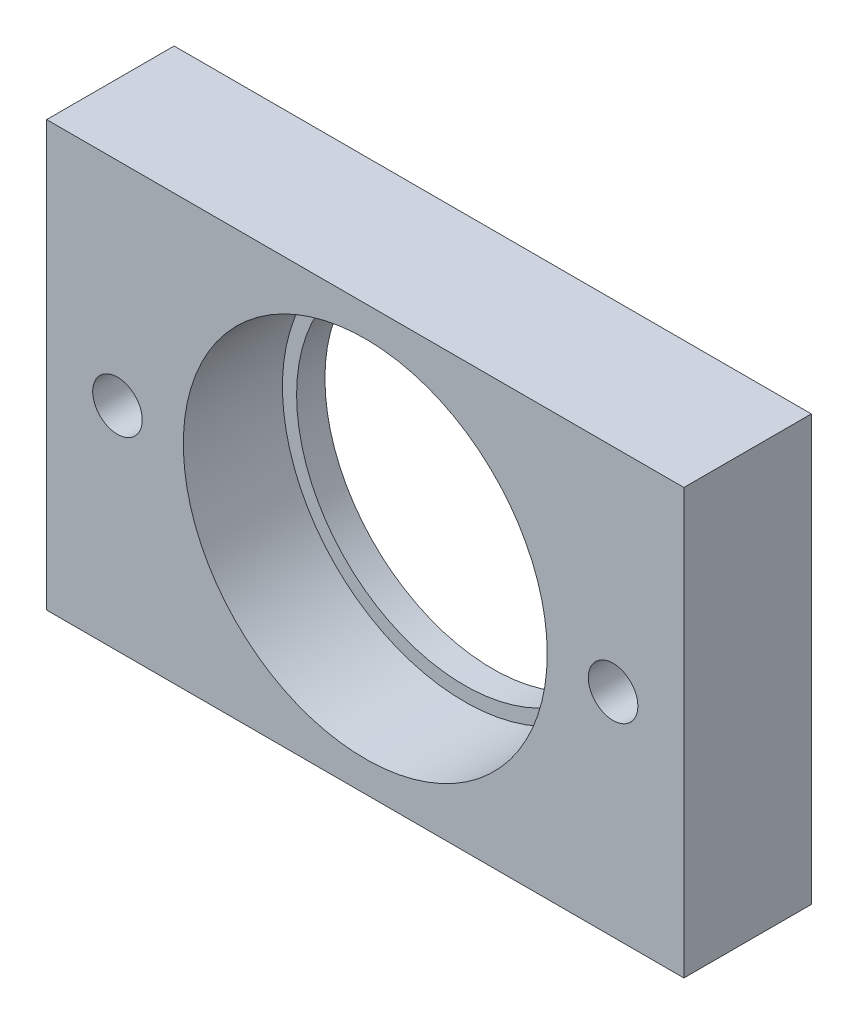
from build123d import *

# Parameters (mm, degrees)
SKIZZE1_W                       = 45
SKIZZE1_H                       = 30
SKIZZE1_R                       = 11.85
SKIZZE1_R_2                     = 1.75
AUFSATZ_LINEAR_AUSTRAGEN1_DEPTH = 9
SKIZZE3_R                       = 12.85
SCHNITT_LINEAR_AUSTRAGEN1_DEPTH = 7


with BuildPart() as part:
    # Skizze1 → Aufsatz-Linear austragen1 (new body)
    with BuildSketch(Plane.XY):
        Rectangle(SKIZZE1_W, SKIZZE1_H)
        Circle(SKIZZE1_R, mode=Mode.SUBTRACT)
        with Locations((-17.5, 0)):
            Circle(SKIZZE1_R_2, mode=Mode.SUBTRACT)
        with Locations((17.5, 0)):
            Circle(SKIZZE1_R_2, mode=Mode.SUBTRACT)
    extrude(amount=AUFSATZ_LINEAR_AUSTRAGEN1_DEPTH)

    # Skizze3 → Schnitt-Linear austragen1 (cut)
    with BuildSketch(Plane.XY.offset(9)):
        Circle(SKIZZE3_R)
    extrude(amount=-SCHNITT_LINEAR_AUSTRAGEN1_DEPTH, mode=Mode.SUBTRACT)


solid = part.part
